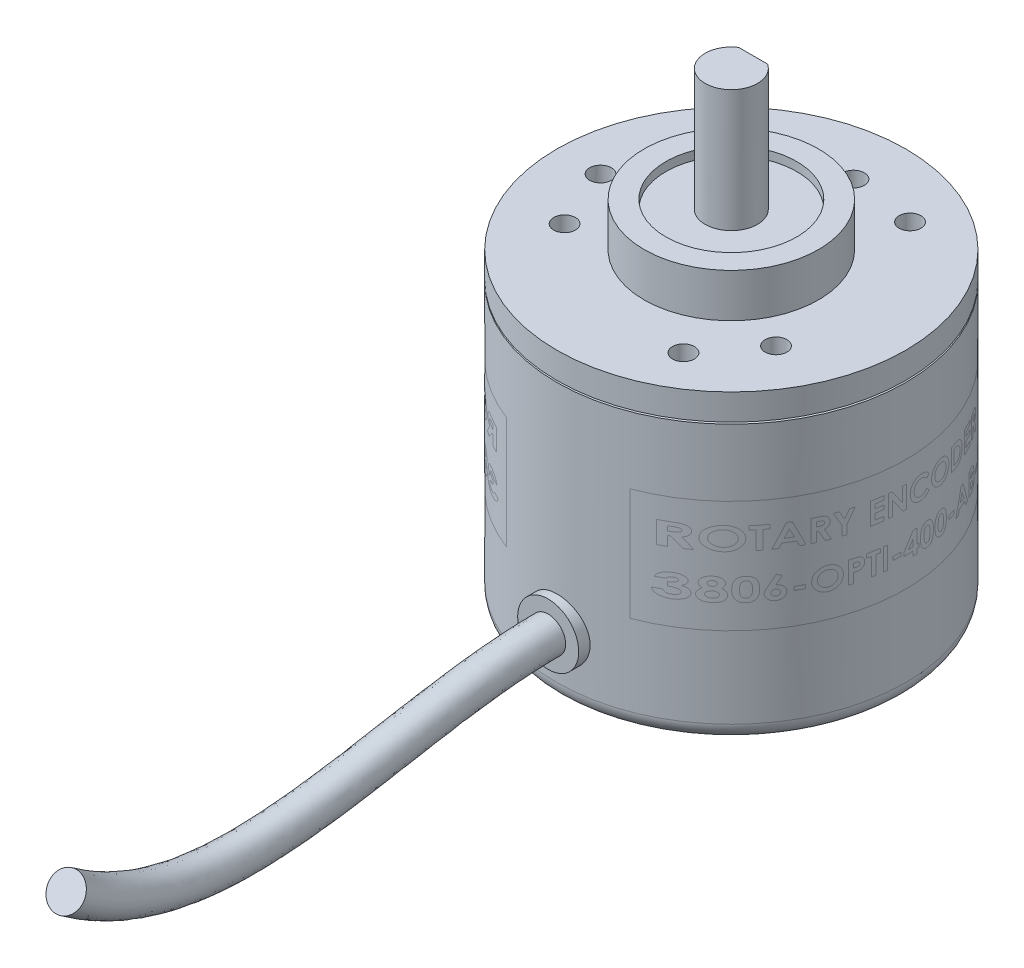
from build123d import *

# Parameters (mm, degrees)
SKETCH1_R                   = 20
BOSS_EXTRUDE1_DEPTH         = 35
SKETCH3_R                   = 10
BOSS_EXTRUDE3_DEPTH         = 5
SKETCH4_R                   = 7.5
CUT_EXTRUDE1_DEPTH          = 1
SKETCH5_R                   = 3
BOSS_EXTRUDE4_DEPTH         = 14
SKETCH6_W                   = 5.83666228
SKETCH6_H                   = 4.189609368
CUT_EXTRUDE2_DEPTH          = 10
TAP_DRILL_FOR_M3_TAP1_D     = 2.5
TAP_DRILL_FOR_M3_TAP1_DEPTH = 8
TAP_DRILL_FOR_M3_TAP1_TIP   = 0.751075774
SKETCH10_W                  = 2.171108564
SKETCH10_H                  = 0.2
SKETCH11_R                  = 3.5
BOSS_EXTRUDE5_DEPTH         = 21
SKETCH12_R                  = 2
FILLET1_R                   = 2


with BuildPart() as part:
    # Sketch1 → Boss-Extrude1 (new body)
    with BuildSketch(Plane(origin=(0, 0, 0), x_dir=(1, 0, 0), z_dir=(0, 1, 0))):
        Circle(SKETCH1_R)
    extrude(amount=BOSS_EXTRUDE1_DEPTH)

    # Sketch3 → Boss-Extrude3 (add)
    with BuildSketch(Plane(origin=(0, 35, 0), x_dir=(1, 0, 0), z_dir=(0, 1, 0))):
        Circle(SKETCH3_R)
    extrude(amount=BOSS_EXTRUDE3_DEPTH)

    # Sketch4 → Cut-Extrude1 (cut)
    with BuildSketch(Plane(origin=(0, 40, 0), x_dir=(1, 0, 0), z_dir=(0, 1, 0))):
        Circle(SKETCH4_R)
    extrude(amount=-CUT_EXTRUDE1_DEPTH, mode=Mode.SUBTRACT)

    # Sketch5 → Boss-Extrude4 (add)
    with BuildSketch(Plane(origin=(0, 39, 0), x_dir=(1, 0, 0), z_dir=(0, 1, 0))):
        Circle(SKETCH5_R)
    extrude(amount=BOSS_EXTRUDE4_DEPTH)

    # Sketch6 → Cut-Extrude2 (cut)
    with BuildSketch(Plane(origin=(0, 53, 0), x_dir=(1, 0, 0), z_dir=(0, 1, 0))):
        with Locations((0, 4.594804684)):
            Rectangle(SKETCH6_W, SKETCH6_H)
    extrude(amount=-CUT_EXTRUDE2_DEPTH, mode=Mode.SUBTRACT)

    # Tap Drill for M3 Tap1
    with Locations(Plane(origin=(0, 35, 0), x_dir=(1, 0, 0), z_dir=(0, 1, 0))):
        with Locations((0, 14), (7.5, 12.990381057), (7.5, -12.990381057), (12.124355653, -7), (-12.124355653, -7), (-15, 0)):
            Hole(TAP_DRILL_FOR_M3_TAP1_D / 2, depth=TAP_DRILL_FOR_M3_TAP1_DEPTH)
            with Locations((0, 0, -(TAP_DRILL_FOR_M3_TAP1_DEPTH + TAP_DRILL_FOR_M3_TAP1_TIP / 2))):  # 118° drill point
                Cone(0, TAP_DRILL_FOR_M3_TAP1_D / 2, TAP_DRILL_FOR_M3_TAP1_TIP, mode=Mode.SUBTRACT)

    # Sketch10 → Cut-Revolve1 (revolve, cut)
    with BuildSketch(Plane.XY):
        with Locations((20, 31.9)):
            Rectangle(SKETCH10_W, SKETCH10_H)
    revolve(axis=Axis((0, 0, 0), (0, 1, 0)), mode=Mode.SUBTRACT)

    # Sketch11 → Boss-Extrude5 (add)
    with BuildSketch(Plane.XY):
        with Locations((0, 7.305759765)):
            Circle(SKETCH11_R)
    extrude(amount=BOSS_EXTRUDE5_DEPTH)

    # Sweep1: sweep along a path in Sketch13
    with BuildLine() as sweep1_path:  # in the path sketch's own coordinates; laid on its plane below (add() does not lay a ready-made edge on the line's plane)
        add(Edge.make_bspline(
            [(-21, 7.305759765), (-39.680829044, 7.305759765), (-58.658536918, -3.239081936), (-76.270922844, 9.376545434)],
            knots=[0, 0, 0, 0, 1, 1, 1, 1], degree=3))
    # Sketch12 → Sweep1 (sweep)
    with BuildSketch(Plane.XY.offset(21)):
        with Locations((0, 7.305759765)):
            Circle(SKETCH12_R)
    sweep(path=Plane(origin=(0, 0, 0), x_dir=(0, 0, -1), z_dir=(1, 0, 0)) * sweep1_path.line)

    # Fillet1
    fillet1_edges = [part.edges().sort_by_distance(p)[0] for p in [
        (-20, 0, 0),
    ]]
    fillet(fillet1_edges, radius=FILLET1_R)


solid = part.part
